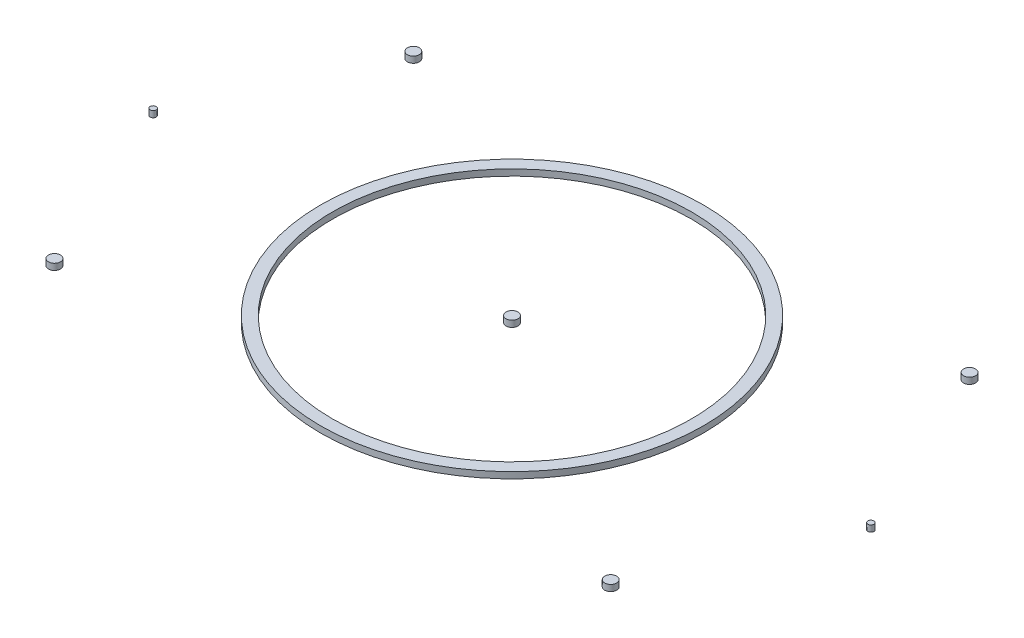
from build123d import *

# Parameters (mm, degrees)
SKETCH_1_R        = 10
EXTRUDE_1_DEPTH   = 10.5
EXTRUDE_1_2_DEPTH = 10.5
EXTRUDE_1_3_DEPTH = 10.5
EXTRUDE_1_4_DEPTH = 10.5
EXTRUDE_1_5_DEPTH = 10.5
SKETCH_1_R_2      = 5
EXTRUDE_1_6_DEPTH = 10.5
EXTRUDE_1_7_DEPTH = 10.5
SKETCH_1_R_3      = 320
SKETCH_1_R_4      = 300
EXTRUDE_1_8_DEPTH = 10.5


with BuildPart() as part:
    # Эскиз1 → Выдавливание1 (new body)
    with BuildSketch(Plane(origin=(0, 0, 0), x_dir=(-1, 0, 0), z_dir=(0, 1, 0))):
        with Locations(Location((-465, -300, 0), (0, 0, 270))):
            Circle(SKETCH_1_R)
    extrude(amount=EXTRUDE_1_DEPTH)


with BuildPart() as body_2:
    # Эскиз1 → Extrude 1 2 (new body)
    with BuildSketch(Plane(origin=(0, 0, 0), x_dir=(-1, 0, 0), z_dir=(0, 1, 0))):
        with Locations(Location((-465, 300, 0), (0, 0, 270))):
            Circle(SKETCH_1_R)
    extrude(amount=EXTRUDE_1_2_DEPTH)


with BuildPart() as body_3:
    # Эскиз1 → Extrude 1 3 (new body)
    with BuildSketch(Plane(origin=(0, 0, 0), x_dir=(-1, 0, 0), z_dir=(0, 1, 0))):
        with Locations(Location((465, 300, 0), (0, 0, 270))):
            Circle(SKETCH_1_R)
    extrude(amount=EXTRUDE_1_3_DEPTH)


with BuildPart() as body_4:
    # Эскиз1 → Extrude 1 4 (new body)
    with BuildSketch(Plane(origin=(0, 0, 0), x_dir=(-1, 0, 0), z_dir=(0, 1, 0))):
        with Locations(Location((0, 0, 0), (0, 0, 270))):
            Circle(SKETCH_1_R)
    extrude(amount=EXTRUDE_1_4_DEPTH)


with BuildPart() as body_5:
    # Эскиз1 → Extrude 1 5 (new body)
    with BuildSketch(Plane(origin=(0, 0, 0), x_dir=(-1, 0, 0), z_dir=(0, 1, 0))):
        with Locations(Location((465, -300, 0), (0, 0, 270))):
            Circle(SKETCH_1_R)
    extrude(amount=EXTRUDE_1_5_DEPTH)


with BuildPart() as body_6:
    # Эскиз1 → Extrude 1 6 (new body)
    with BuildSketch(Plane(origin=(0, 0, 0), x_dir=(-1, 0, 0), z_dir=(0, 1, 0))):
        with Locations(Location((-600, 0, 0), (0, 0, 270))):
            Circle(SKETCH_1_R_2)
    extrude(amount=EXTRUDE_1_6_DEPTH)


with BuildPart() as body_7:
    # Эскиз1 → Extrude 1 7 (new body)
    with BuildSketch(Plane(origin=(0, 0, 0), x_dir=(-1, 0, 0), z_dir=(0, 1, 0))):
        with Locations(Location((600, 0, 0), (0, 0, 270))):
            Circle(SKETCH_1_R_2)
    extrude(amount=EXTRUDE_1_7_DEPTH)


with BuildPart() as body_8:
    # Эскиз1 → Extrude 1 8 (new body)
    with BuildSketch(Plane(origin=(0, 0, 0), x_dir=(-1, 0, 0), z_dir=(0, 1, 0))):
        with Locations(Location((0, 0, 0), (0, 0, 270))):
            Circle(SKETCH_1_R_3)
        with Locations(Location((0, 0, 0), (0, 0, 270))):
            Circle(SKETCH_1_R_4, mode=Mode.SUBTRACT)
    extrude(amount=EXTRUDE_1_8_DEPTH)


solid = Compound([part.part, body_2.part, body_3.part, body_4.part, body_5.part, body_6.part, body_7.part, body_8.part])
